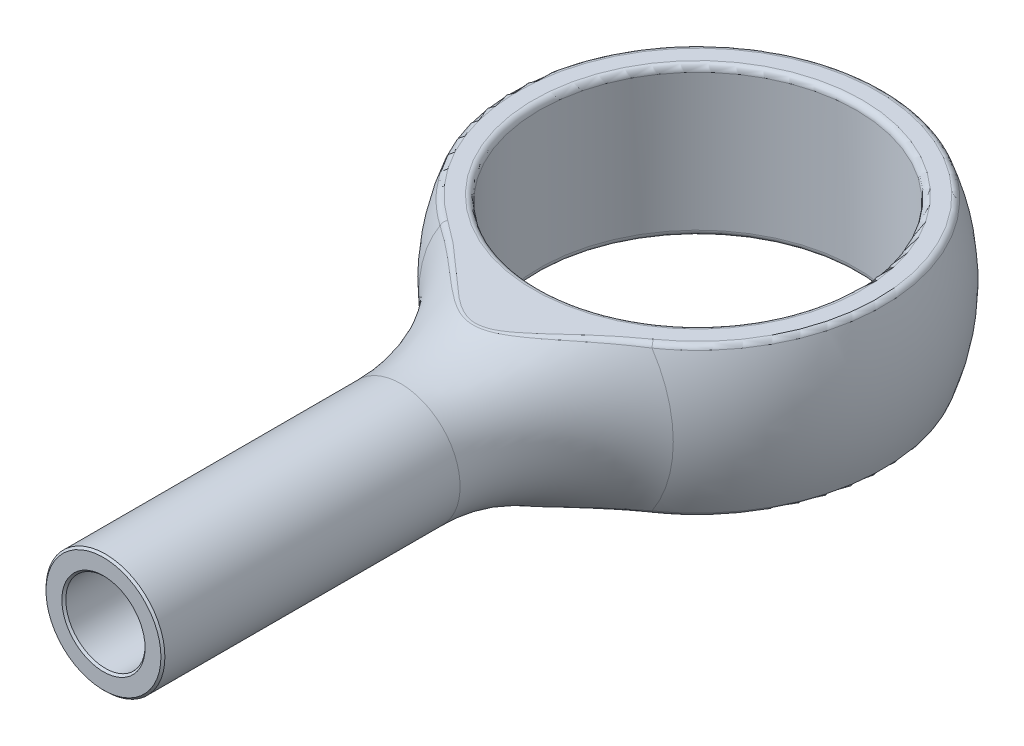
from build123d import *

# Parameters (mm, degrees)
CUT_EXTRUDE1_DEPTH = 5
SKETCH5_R          = 4
CUT_EXTRUDE2_DEPTH = 5
FILLET1_R          = 0.15
SKETCH6_R          = 1
CUT_EXTRUDE3_DEPTH = 5
CHAMFER1_SIZE      = 0.05


with BuildPart() as part:
    # Sketch2 → Revolve1 (revolve)
    with BuildSketch(Plane(origin=(0, 0, 0), x_dir=(1, 0, 0), z_dir=(0, 1, 0))):
        with BuildLine():
            Line((-1.5, -15), (0, -15))
            Line((0, -15), (0, 5))
            ThreePointArc((0, 5), (-4.698967117, 1.708715315), (-3.211678832, -3.832116788))
            ThreePointArc((-3.211678832, -3.832116788), (-1.948980687, -5.476190987), (-1.5, -7.5))
            Line((-1.5, -7.5), (-1.5, -15))
        make_face()
    revolve(axis=Axis((0, 0, -5), (0, 0, 1)))

    # Sketch3 → Cut-Extrude1 (cut, symmetric)
    with BuildSketch(Plane(origin=(0, 0, 0), x_dir=(0, 0, -1), z_dir=(1, 0, 0))):
        with BuildLine():
            Line((-23.803792398, 13.487490708), (13.982452883, 13.487490708))
            Line((13.982452883, 13.487490708), (13.982452883, 1.875))
            Line((13.982452883, 1.875), (-5.642942996, 1.875))
            ThreePointArc((-5.642942996, 1.875), (-7.146471994, 2.106415246), (-8.510825178, 2.779239779))
            Line((-8.510825178, 2.779239779), (-23.803792398, 13.487490708))
        make_face()
        with BuildLine():
            Line((-8.510825178, -2.779239779), (-23.803792398, -13.487490708))
            Line((-23.803792398, -13.487490708), (13.982452883, -13.487490708))
            Line((13.982452883, -13.487490708), (13.982452883, -1.875))
            Line((13.982452883, -1.875), (-5.642942996, -1.875))
            ThreePointArc((-5.642942996, -1.875), (-7.146471994, -2.106415246), (-8.510825178, -2.779239779))
        make_face()
    extrude(amount=CUT_EXTRUDE1_DEPTH, both=True, mode=Mode.SUBTRACT)

    # Sketch5 → Cut-Extrude2 (cut, symmetric)
    with BuildSketch(Plane(origin=(0, 0, 0), x_dir=(1, 0, 0), z_dir=(0, 1, 0))):
        with Locations(Location((0, 0, 0), (0, 0, 270))):
            Circle(SKETCH5_R)
    extrude(amount=CUT_EXTRUDE2_DEPTH, both=True, mode=Mode.SUBTRACT)

    # Fillet1
    fillet1_edges = [part.edges().sort_by_distance(p)[0] for p in [
        (1e-09, -1.875, 5.642942998),
        (-1e-09, 1.875, 5.642942998),
        (0, 1.875, -4.635124054),
        (0, -1.875, -4.635124054),
        (0, 1.875, -4),
        (0, -1.875, -4),
    ]]
    fillet(fillet1_edges, radius=FILLET1_R)

    # Sketch6 → Cut-Extrude3 (cut)
    with BuildSketch(Plane.XY.offset(15)):
        Circle(SKETCH6_R)
    extrude(amount=-CUT_EXTRUDE3_DEPTH, mode=Mode.SUBTRACT)

    # Chamfer1
    chamfer1_edges = [part.edges().sort_by_distance(p)[0] for p in [
        (1.5, 0, 15),
        (-1, 0, 15),
    ]]
    chamfer(chamfer1_edges, length=CHAMFER1_SIZE)


solid = part.part
